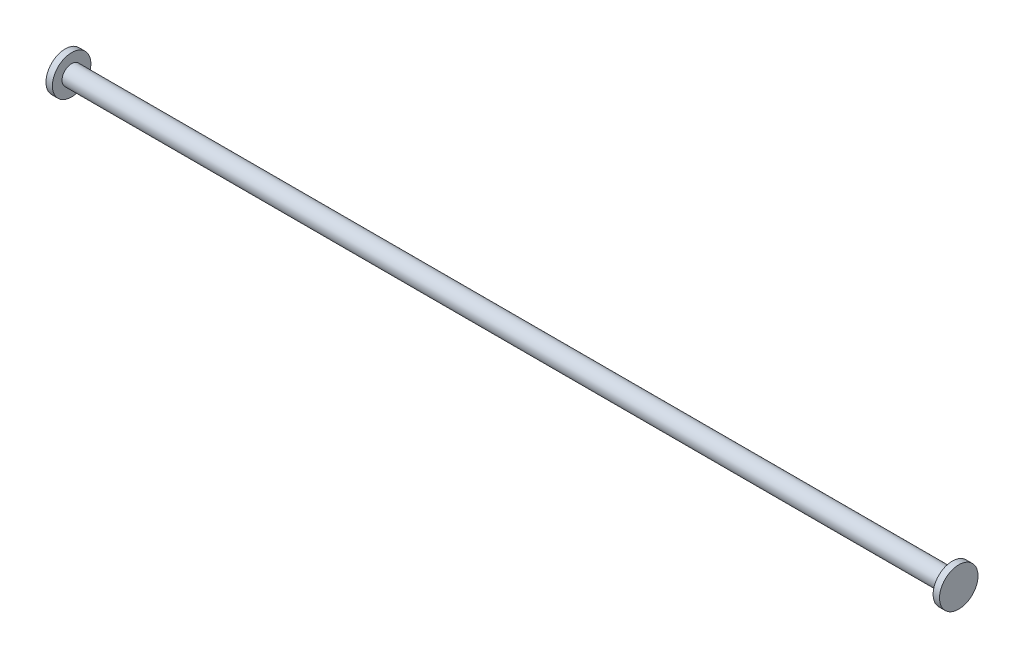
from build123d import *

# Parameters (mm, degrees)
SKETCH1_R           = 38.1
BOSS_EXTRUDE1_DEPTH = 1743.6465
SKETCH2_R           = 76.2
BOSS_EXTRUDE2_DEPTH = 25.4


with BuildPart() as part:
    # Sketch1 → Boss-Extrude1 (new, symmetric)
    with BuildSketch(Plane(origin=(0, 0, 0), x_dir=(0, 0, -1), z_dir=(1, 0, 0))):
        Circle(SKETCH1_R)
    extrude(amount=BOSS_EXTRUDE1_DEPTH, both=True)

    # Sketch2 → Boss-Extrude2 (add)
    with BuildSketch(Plane(origin=(1743.6465, 0, 0), x_dir=(0, 0, -1), z_dir=(1, 0, 0))):
        Circle(SKETCH2_R)
    boss_extrude2 = extrude(amount=BOSS_EXTRUDE2_DEPTH)

    # Mirror1: Boss-Extrude2 across plane
    add(boss_extrude2.mirror(Plane(origin=(0, 0, 0), x_dir=(0, 0, 1), z_dir=(1, 0, 0))))


solid = part.part
